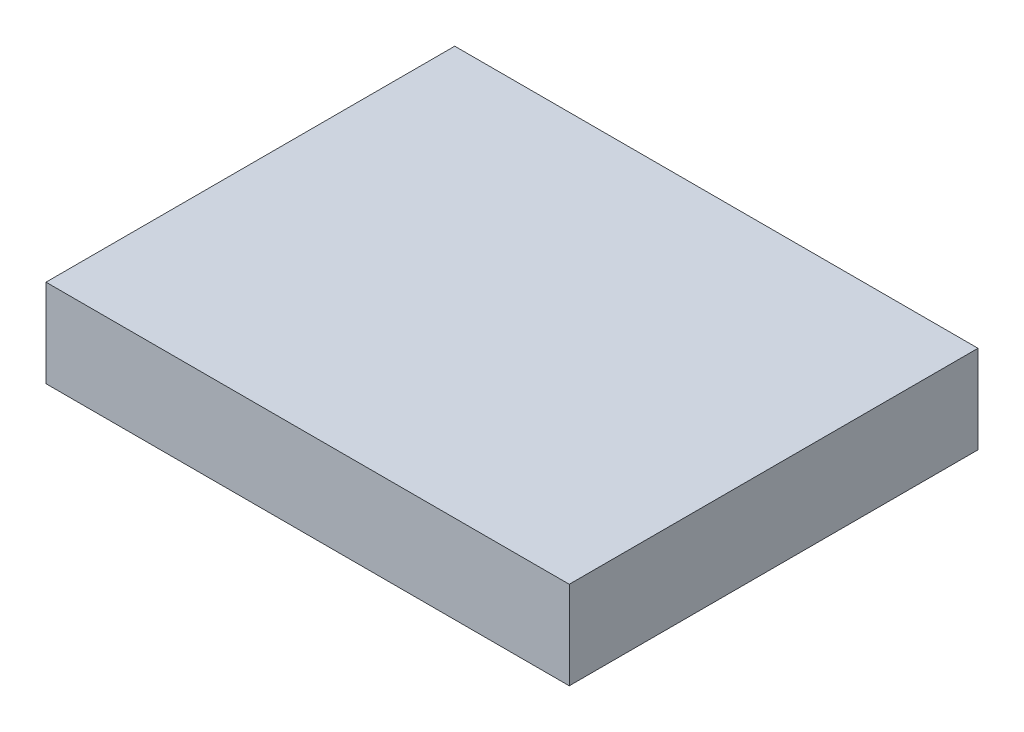
from build123d import *

# Parameters (mm, degrees)
SKETCH_1_W      = 69
SKETCH_1_H      = 53.9
EXTRUDE_1_DEPTH = 11.6


with BuildPart() as part:
    # 草圖1 → 填料-伸長1 (new body)
    with BuildSketch(Plane(origin=(0, 0, 0), x_dir=(1, 0, 0), z_dir=(0, 1, 0))):
        Rectangle(SKETCH_1_W, SKETCH_1_H)
    extrude(amount=EXTRUDE_1_DEPTH)


solid = part.part
